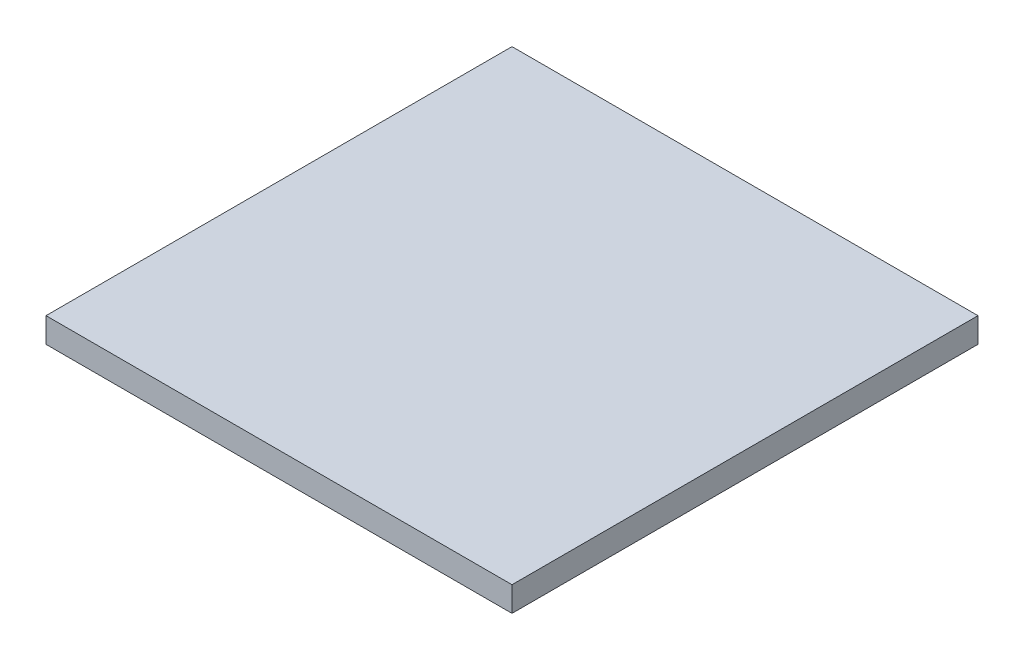
from build123d import *

# Parameters (mm, degrees)
SKETCH1_W = 60
SKETCH1_H = 60
TOP_DEPTH = 3.2


with BuildPart() as part:
    # Sketch1 → Top (new body)
    with BuildSketch(Plane(origin=(0, 0, 0), x_dir=(1, 0, 0), z_dir=(0, 1, 0))):
        with Locations((-30, 30)):
            Rectangle(SKETCH1_W, SKETCH1_H)
    extrude(amount=TOP_DEPTH)


solid = part.part
